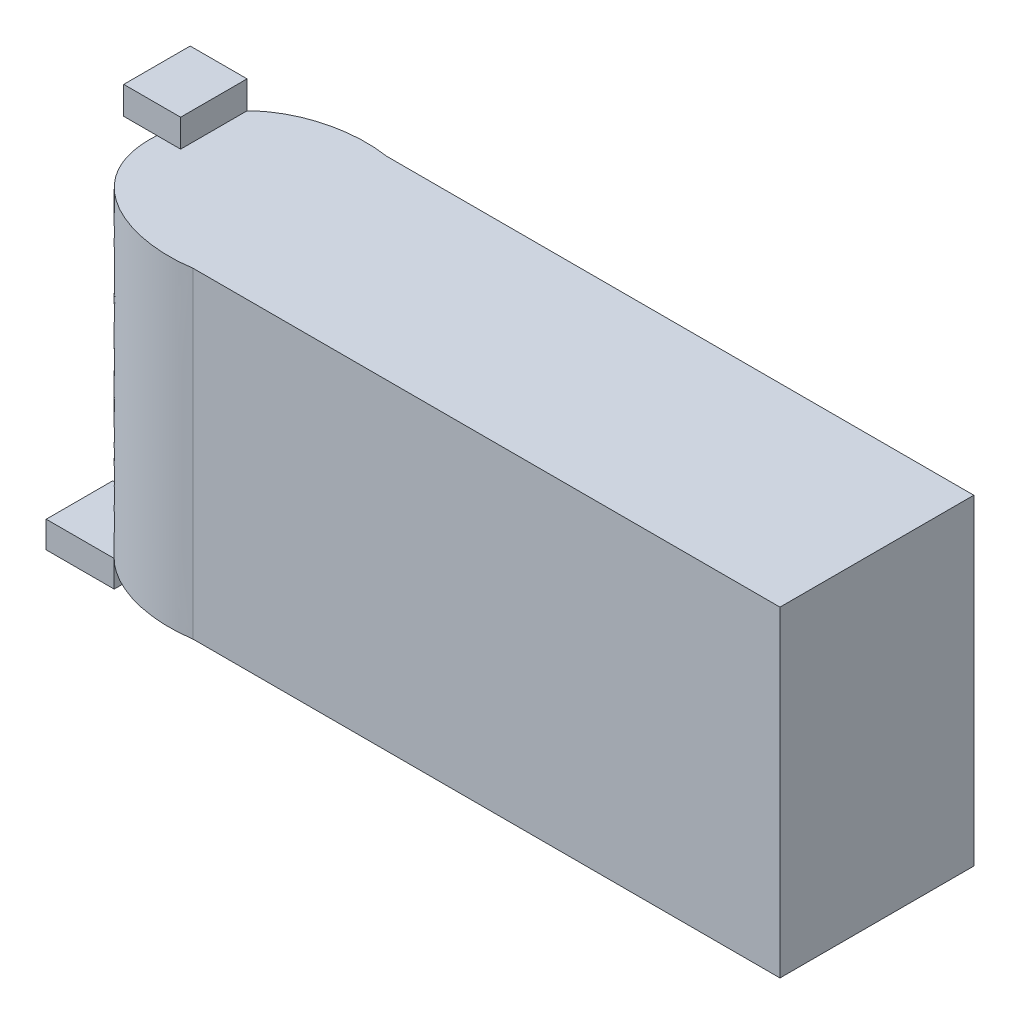
from build123d import *

# Parameters (mm, degrees)
SKETCH2_W           = 53
SKETCH2_H           = 17.5
BOSS_EXTRUDE1_DEPTH = 29
BOSS_EXTRUDE2_DEPTH = 2.5
BOSS_EXTRUDE3_DEPTH = 2.4


with BuildPart() as part:
    # Sketch2 → Boss-Extrude1 (new body)
    with BuildSketch(Plane(origin=(0, 0, 0), x_dir=(1, 0, 0), z_dir=(0, 1, 0))):
        Rectangle(SKETCH2_W, SKETCH2_H)
        with BuildLine():
            add(Edge.make_bspline(
                [(-26.5, -8.75), (-31.844612433, -9.598662384), (-38.964801167, -6.953731951), (-38.5, 0)],
                knots=[0, 0, 0, 0, 1, 1, 1, 1], degree=3))
            add(Edge.make_bspline(
                [(-26.5, 8.75), (-31.844612433, 9.598662384), (-38.964801167, 6.953731951), (-38.5, 0)],
                knots=[0, 0, 0, 0, 1, 1, 1, 1], degree=3))
            Line((-26.5, 8.75), (-26.5, -8.75))
        make_face()
    extrude(amount=BOSS_EXTRUDE1_DEPTH)

    # Sketch3 → Boss-Extrude2 (add)
    with BuildSketch(Plane(origin=(0, 29, 0), x_dir=(1, 0, 0), z_dir=(0, 1, 0))):
        Polygon((-38.5, 6), (-36.365233695, 6), (-36.365233695, 0), (-38.5, 0), (-41.5, 0), (-41.5, 6), align=None)
    extrude(amount=BOSS_EXTRUDE2_DEPTH)

    # Sketch4 → Boss-Extrude3 (add)
    with BuildSketch(Plane.XZ):
        Polygon((-38.5, 6), (-36.365233695, 6), (-36.365233695, 0), (-38.5, 0), (-42.5, 0), (-42.5, 6), align=None)
    extrude(amount=BOSS_EXTRUDE3_DEPTH)


solid = part.part
